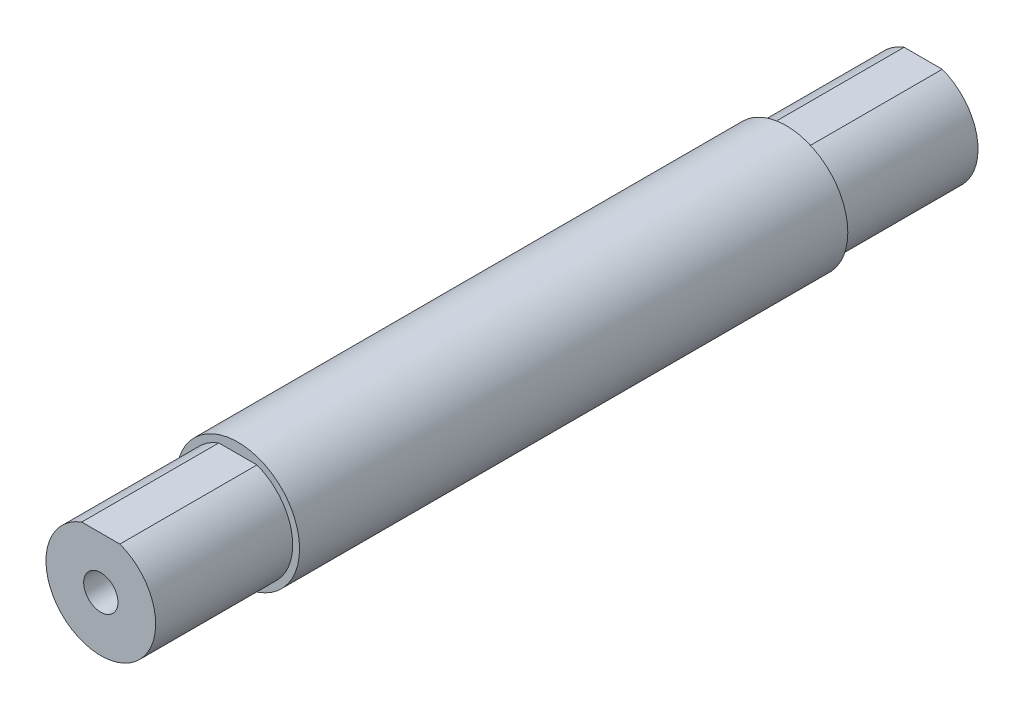
from build123d import *

# Parameters (mm, degrees)
EXTRUDE_1_DEPTH = 60
SKETCH_1_3_R    = 9
EXTRUDE_2_DEPTH = 40


with BuildPart() as part:
    # 草图1 → 凸台-拉伸1 (new, symmetric)
    with BuildSketch(Plane.XY):
        with BuildLine():
            Line((2.783882181, 7.5), (-2.783882181, 7.5))
            ThreePointArc((-2.783882181, 7.5), (-4.567764363, -6.567764363), (8, 0))
            ThreePointArc((8, 0), (6.567764363, 4.567764363), (2.783882181, 7.5))
        make_face()
    extrude(amount=EXTRUDE_1_DEPTH, both=True)

    # 草图1<3> → 凸台-拉伸2 (add, symmetric)
    with BuildSketch(Plane.XY):
        Circle(SKETCH_1_3_R)
        with BuildLine():
            Line((-2.783882181, 7.5), (2.783882181, 7.5))
            ThreePointArc((2.783882181, 7.5), (0, -8), (-2.783882181, 7.5))
        make_face(mode=Mode.SUBTRACT)
    extrude(amount=EXTRUDE_2_DEPTH, both=True)

    # 草图4 → M6 螺纹孔1 (revolve, cut)
    with BuildSketch(Plane(origin=(0, 0, 60), x_dir=(0, -1, 0), z_dir=(1, 0, 0))):
        Polygon((0, 0), (0, 19.502151548), (2.5, 18), (2.5, 0), align=None)
    hole_wizard_m6_1 = revolve(axis=Axis((0, 0, 66.35), (0, 0, -1)), mode=Mode.SUBTRACT)

    # 镜向1: M6 螺纹孔1 across plane
    add(hole_wizard_m6_1.mirror(Plane.XY), mode=Mode.SUBTRACT)


solid = part.part
